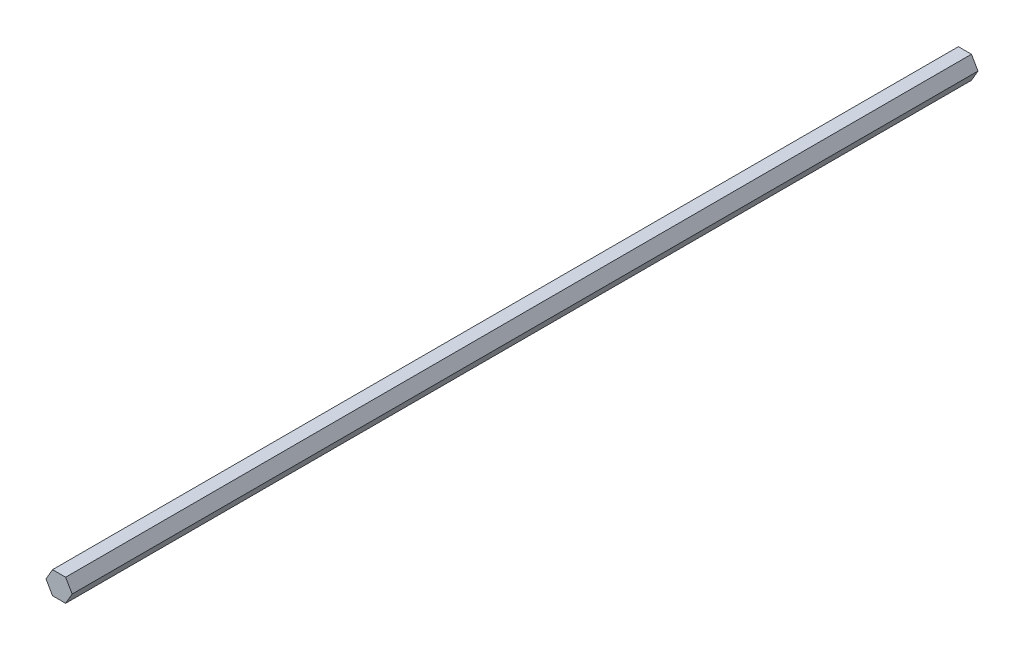
from build123d import *

# Parameters (mm, degrees)
BOSS_EXTRUDE1_DEPTH = 200


with BuildPart() as part:
    # Sketch1 → Boss-Extrude1 (new body)
    with BuildSketch(Plane.XY):
        Polygon((2.886751346, 0), (1.443375673, 2.5), (-1.443375673, 2.5), (-2.886751346, 0), (-1.443375673, -2.5), (1.443375673, -2.5), align=None)
    extrude(amount=BOSS_EXTRUDE1_DEPTH)


solid = part.part
